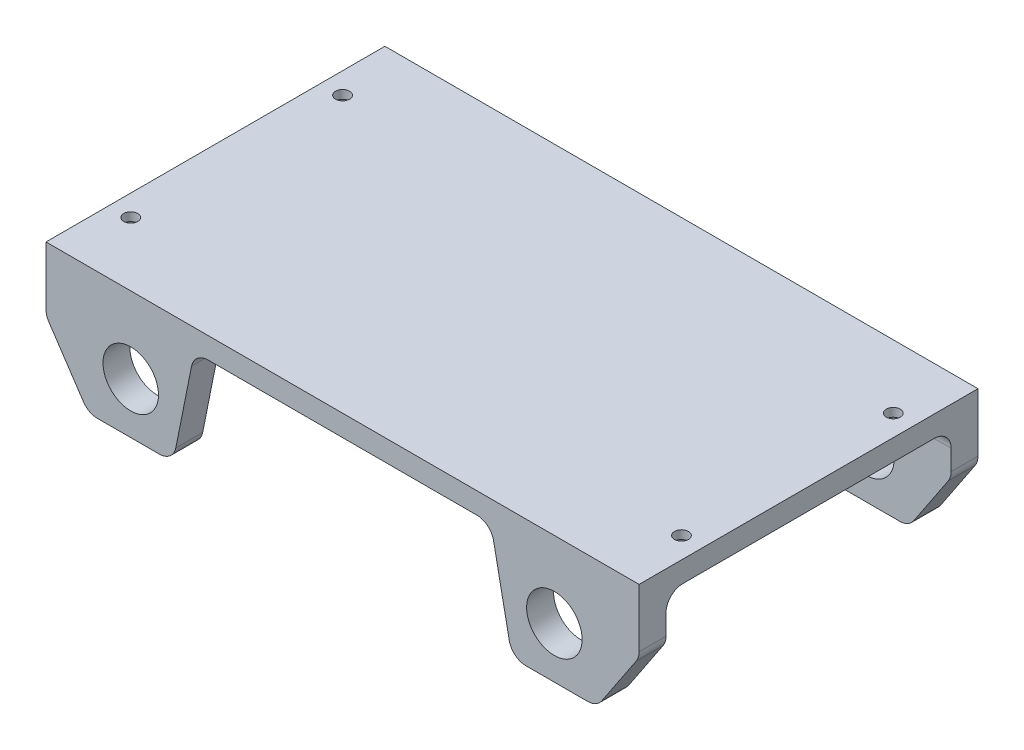
from build123d import *

# Parameters (mm, degrees)
CROQUIS1_W                 = 140
CROQUIS1_H                 = 30
SALIENTE_EXTRUIR1_DEPTH    = 40
CORTAR_EXTRUIR1_DEPTH      = 83.006097334
CORTAR_EXTRUIR1_DEPTH_BACK = 83.006097334
CROQUIS2_W                 = 67.3
CROQUIS2_H                 = 25
CROQUIS3_R                 = 6.55
CORTAR_EXTRUIR2_DEPTH      = 80
CORTAR_EXTRUIR3_REACH      = 86.41
CROQUIS4_R                 = 1.651
CROQUIS5_R                 = 3.5
CROQUIS5_R_2               = 1.651
CORTAR_EXTRUIR4_DEPTH      = 3
CORTAR_EXTRUIR5_DEPTH      = 83.006097334
CORTAR_EXTRUIR5_DEPTH_BACK = 83.006097334
REDONDEO1_R                = 4


with BuildPart() as part:
    # Croquis1 → Saliente-Extruir1 (new, symmetric)
    with BuildSketch(Plane.XY):
        Rectangle(CROQUIS1_W, CROQUIS1_H)
    extrude(amount=SALIENTE_EXTRUIR1_DEPTH, both=True)

    # Croquis2 → Cortar-Extruir1 (cut, two sides: drawn at the far end of the back side and taken through both)
    with BuildSketch(Plane(origin=(0, 0, 0), x_dir=(0, 0, -1), z_dir=(1, 0, 0)).offset(-CORTAR_EXTRUIR1_DEPTH_BACK)):
        with Locations((0, -2.5)):
            Rectangle(CROQUIS2_W, CROQUIS2_H)
    extrude(amount=CORTAR_EXTRUIR1_DEPTH + CORTAR_EXTRUIR1_DEPTH_BACK, mode=Mode.SUBTRACT)

    # Croquis3 → Cortar-Extruir2 (cut)
    with BuildSketch(Plane.XY.offset(40)):
        with Locations((50, -3)):
            Circle(CROQUIS3_R)
        with Locations((-50, -3)):
            Circle(CROQUIS3_R)
    extrude(amount=-CORTAR_EXTRUIR2_DEPTH, mode=Mode.SUBTRACT)

    # Croquis4 → Cortar-Extruir3 (cut, up to next)
    with BuildSketch(Plane.XZ.offset(-10), mode=Mode.PRIVATE) as cortar_extruir3_sk1:
        with Locations(Location((-65, 25, 0), (0, 0, 270))):
            Circle(CROQUIS4_R)
    cortar_extruir3_tool1 = extrude(cortar_extruir3_sk1.sketch, amount=-CORTAR_EXTRUIR3_REACH, mode=Mode.PRIVATE) & part.part
    # Croquis4 → Cortar-Extruir3 (cut, up to next)
    with BuildSketch(Plane.XZ.offset(-10), mode=Mode.PRIVATE) as cortar_extruir3_sk2:
        with Locations(Location((-65, -25, 0), (0, 0, 270))):
            Circle(CROQUIS4_R)
    cortar_extruir3_tool2 = extrude(cortar_extruir3_sk2.sketch, amount=-CORTAR_EXTRUIR3_REACH, mode=Mode.PRIVATE) & part.part
    cortar_extruir3_1 = cortar_extruir3_tool1.solids().sort_by_distance((-65, 10, 25))[0]
    add(cortar_extruir3_1, mode=Mode.SUBTRACT)
    cortar_extruir3_2 = cortar_extruir3_tool2.solids().sort_by_distance((-65, 10, -25))[0]
    add(cortar_extruir3_2, mode=Mode.SUBTRACT)
    cortar_extruir3 = cortar_extruir3_1 + cortar_extruir3_2  # Cortar-Extruir3 as one shape, for the pattern or mirror that repeats it

    # Croquis5 → Cortar-Extruir4 (cut)
    # profile 1 of 2: a face of its own
    with BuildSketch(Plane.XZ.offset(-10)):
        with Locations(Location((-65, 25, 0), (0, 0, 270))):
            Circle(CROQUIS5_R)
        with Locations(Location((-65, 25, 0), (0, 0, 270))):
            Circle(CROQUIS5_R_2, mode=Mode.SUBTRACT)
    # profile 2 of 2: a face of its own
    with BuildSketch(Plane.XZ.offset(-10)):
        with Locations(Location((-65, -25, 0), (0, 0, 270))):
            Circle(CROQUIS5_R)
        with Locations(Location((-65, -25, 0), (0, 0, 270))):
            Circle(CROQUIS5_R_2, mode=Mode.SUBTRACT)
    cortar_extruir4 = extrude(amount=-CORTAR_EXTRUIR4_DEPTH, mode=Mode.SUBTRACT)

    # Croquis9 → Cortar-Extruir5 (cut, two sides: drawn at the far end of the back side and taken through both)
    with BuildSketch(Plane.XY.offset(-CORTAR_EXTRUIR5_DEPTH_BACK)):
        Polygon((-40, -15), (-35, 10), (35, 10), (40, -15), align=None)
        Polygon((-70, 0), (-60, -15), (-70, -15), align=None)
        Polygon((70, 0), (60, -15), (70, -15), align=None)
    extrude(amount=CORTAR_EXTRUIR5_DEPTH + CORTAR_EXTRUIR5_DEPTH_BACK, mode=Mode.SUBTRACT)

    # Simetría4: Cortar-Extruir3, Cortar-Extruir4 across plane
    add(cortar_extruir3.mirror(Plane(origin=(0, 0, 0), x_dir=(0, 0, 1), z_dir=(1, 0, 0))), mode=Mode.SUBTRACT)
    add(cortar_extruir4.mirror(Plane(origin=(0, 0, 0), x_dir=(0, 0, 1), z_dir=(1, 0, 0))), mode=Mode.SUBTRACT)

    # Redondeo1
    redondeo1_edges = [part.edges().sort_by_distance(p)[0] for p in [
        (-70, 0, 36.825),
        (-70, 0, -36.825),
        (-60, -15, 36.825),
        (-60, -15, -36.825),
        (70, 0, 36.825),
        (70, 0, -36.825),
        (60, -15, 36.825),
        (60, -15, -36.825),
        (-52.5, 10, 33.65),
        (-52.5, 10, -33.65),
        (52.5, 10, -33.65),
        (52.5, 10, 33.65),
        (40, -15, 36.825),
        (40, -15, -36.825),
        (-40, -15, 36.825),
        (-40, -15, -36.825),
        (-35, 10, 36.825),
        (-35, 10, -36.825),
        (35, 10, 36.825),
        (35, 10, -36.825),
    ]]
    fillet(redondeo1_edges, radius=REDONDEO1_R)


solid = part.part
